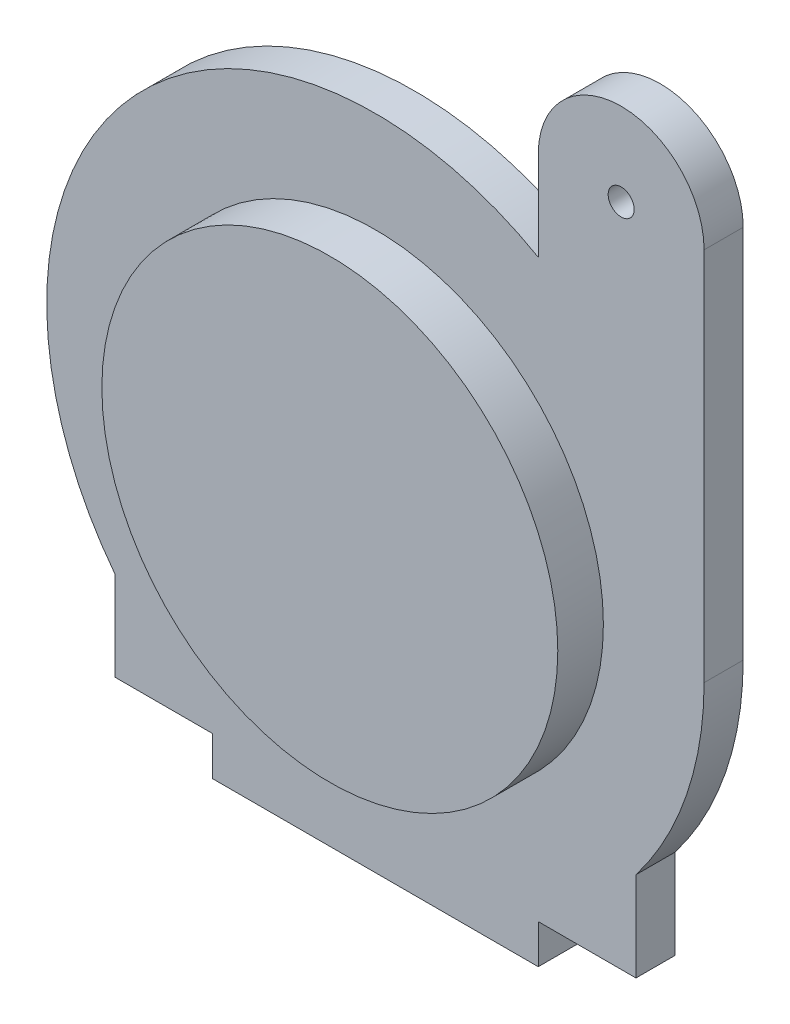
from build123d import *

# Parameters (mm, degrees)
SKETCH1_R           = 17.265633628
SKETCH1_R_2         = 1
SKETCH1_R_3         = 10
SKETCH1_W           = 25
SKETCH1_H           = 3
BOSS_EXTRUDE5_DEPTH = 3
SKETCH2_R           = 17.5
BOSS_EXTRUDE6_DEPTH = 6.5


with BuildPart() as part:
    # Sketch1 → Boss-Extrude5 (new body)
    # profile 1 of 3: a face of its own
    with BuildSketch(Plane.XY):
        with BuildLine():
            Line((0, 0), (7.5, 0))
            Line((7.5, 0), (32.5, 0))
            Line((32.5, 0), (40, 0))
            Line((40, 0), (40, 6.867081787))
            ThreePointArc((40, 6.867081787), (43.887871625, 14.125845764), (45.231531638, 22.249870507))
            Line((45.231531638, 22.249870507), (45.231531638, 51.023857348))
            ThreePointArc((45.231531638, 51.023857348), (38.865765819, 57.389623167), (32.5, 51.023857348))
            Line((32.5, 51.023857348), (32.5, 44.167447672))
            ThreePointArc((32.5, 44.167447672), (0.97654543, 38.82510399), (0, 6.867081787))
            Line((0, 6.867081787), (0, 0))
        make_face()
        with Locations((20, 22.249870507)):
            Circle(SKETCH1_R, mode=Mode.SUBTRACT)
        with Locations((38.865765819, 51.023857348)):
            Circle(SKETCH1_R_2, mode=Mode.SUBTRACT)
    # profile 2 of 3: a face of its own
    with BuildSketch(Plane.XY):
        with Locations((20, 22.249870507)):
            Circle(SKETCH1_R)
        with Locations((20, 22.249870507)):
            Circle(SKETCH1_R_3, mode=Mode.SUBTRACT)
    # profile 3 of 3: a face of its own
    with BuildSketch(Plane.XY):
        with Locations((20, -1.5)):
            Rectangle(SKETCH1_W, SKETCH1_H)
    extrude(amount=BOSS_EXTRUDE5_DEPTH)

    # Sketch2 → Boss-Extrude6 (add)
    with BuildSketch(Plane(origin=(0, 0, 0), x_dir=(-1, 0, 0), z_dir=(0, 0, -1))):
        with Locations((-20, 22.249870507)):
            Circle(SKETCH2_R)
    extrude(amount=-BOSS_EXTRUDE6_DEPTH)


solid = part.part
